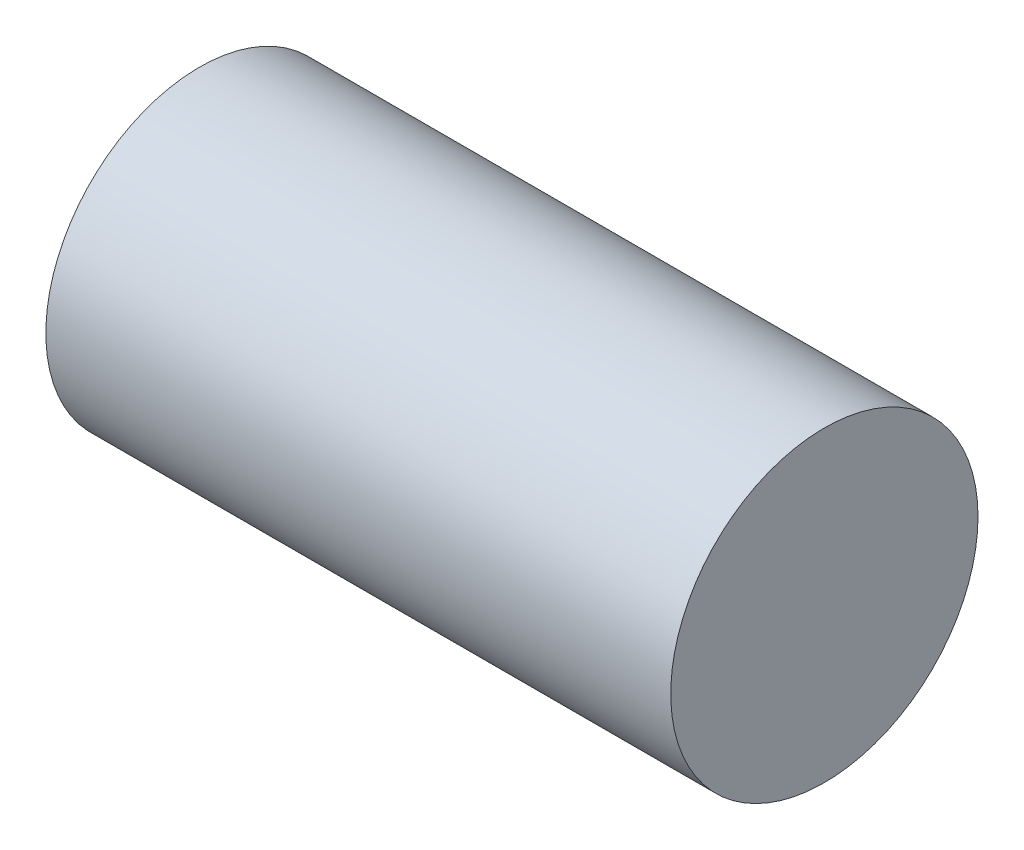
from build123d import *

# Parameters (mm, degrees)
SKETCH1_R           = 2.95
BOSS_EXTRUDE1_DEPTH = 12


with BuildPart() as part:
    # Sketch1 → Boss-Extrude1 (new body)
    with BuildSketch(Plane(origin=(0, 0, 0), x_dir=(0, 0, -1), z_dir=(1, 0, 0))):
        Circle(SKETCH1_R)
    extrude(amount=BOSS_EXTRUDE1_DEPTH)


solid = part.part
